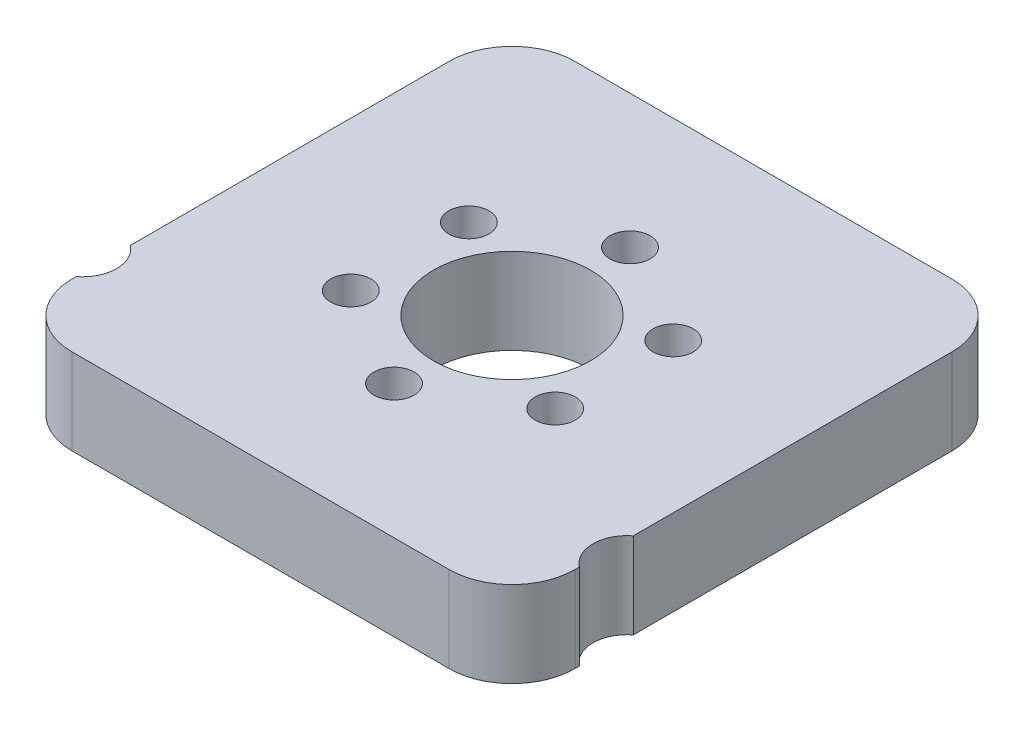
from build123d import *

# Parameters (mm, degrees)
SKETCH1_R           = 6.25
BOSS_EXTRUDE1_DEPTH = 6.825
SKETCH6_R           = 1.6
CUT_EXTRUDE1_DEPTH  = 30.096058582
FILLET2_R           = 5


with BuildPart() as part:
    # Sketch1 → Boss-Extrude1 (new body)
    with BuildSketch(Plane(origin=(0, 0, 0), x_dir=(1, 0, 0), z_dir=(0, 1, 0))):
        with BuildLine():
            Line((-20, -14.645854519), (-20, -20))
            Line((-20, -20), (20, -20))
            Line((20, -20), (20, -14.645854519))
            ThreePointArc((20, -14.645854519), (18.943369346, -12.5), (20, -10.354145481))
            Line((20, -10.354145481), (20, 20))
            Line((20, 20), (-20, 20))
            Line((-20, 20), (-20, -10.354145481))
            ThreePointArc((-20, -10.354145481), (-19.221849833, -11.304052681), (-18.943369346, -12.5))
            ThreePointArc((-18.943369346, -12.5), (-19.221849833, -13.695947319), (-20, -14.645854519))
        make_face()
        Circle(SKETCH1_R, mode=Mode.SUBTRACT)
    extrude(amount=BOSS_EXTRUDE1_DEPTH)

    # Sketch6 → Cut-Extrude1 (cut, through all)
    with BuildSketch(Plane(origin=(0, 6.825, 0), x_dir=(1, 0, 0), z_dir=(0, 1, 0))):
        with Locations((0, -9.385)):
            Circle(SKETCH6_R)
        with Locations((-8.127648415, -4.6925)):
            Circle(SKETCH6_R)
        with Locations((-8.127648415, 4.6925)):
            Circle(SKETCH6_R)
        with Locations((0, 9.385)):
            Circle(SKETCH6_R)
        with Locations((8.127648415, 4.6925)):
            Circle(SKETCH6_R)
        with Locations((8.127648415, -4.6925)):
            Circle(SKETCH6_R)
    extrude(amount=-CUT_EXTRUDE1_DEPTH, mode=Mode.SUBTRACT)

    # Fillet2
    fillet2_edges = [part.edges().sort_by_distance(p)[0] for p in [
        (20, 3.4125, 20),
        (20, 3.4125, -20),
        (-20, 3.4125, -20),
        (-20, 3.4125, 20),
    ]]
    fillet(fillet2_edges, radius=FILLET2_R)


solid = part.part
